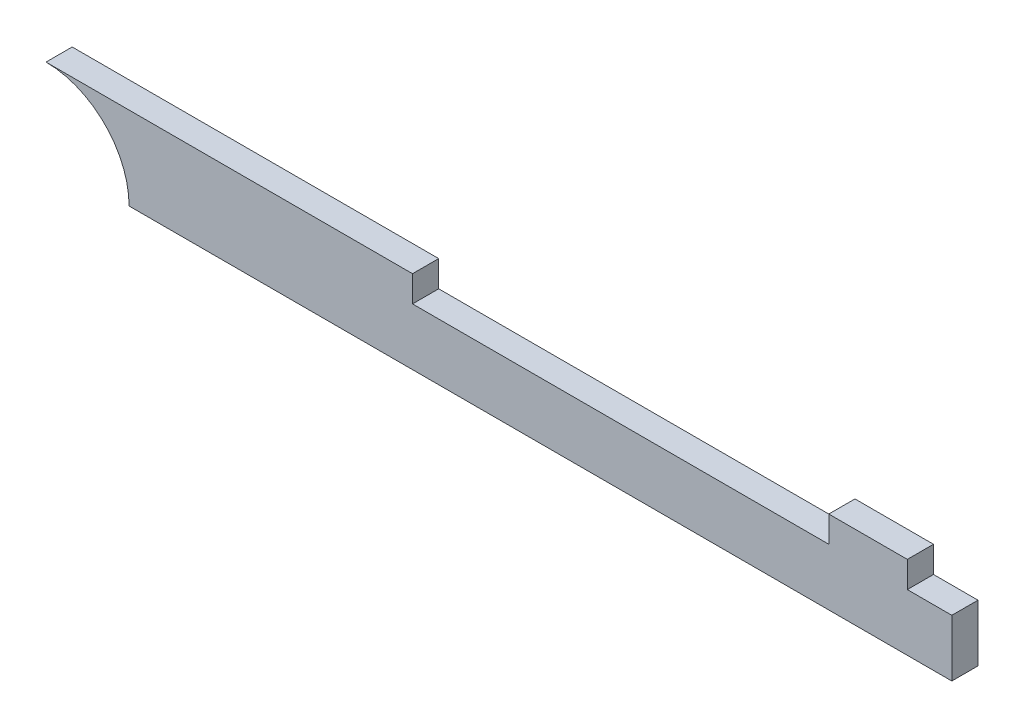
from build123d import *

# Parameters (mm, degrees)
BOSS_EXTRUDE1_DEPTH = 2.5


with BuildPart() as part:
    # Sketch1 → Boss-Extrude1 (new, symmetric)
    with BuildSketch(Plane.XY):
        with BuildLine():
            ThreePointArc((0, 15.875), (11.225320151, 11.225320151), (15.875, 0))
            Line((15.875, 0), (173, 0))
            Line((173, 0), (173, 10.875))
            Line((173, 10.875), (164.5, 10.875))
            Line((164.5, 10.875), (164.5, 15.875))
            Line((164.5, 15.875), (149.5, 15.875))
            Line((149.5, 15.875), (149.5, 10.875))
            Line((149.5, 10.875), (70, 10.875))
            Line((70, 10.875), (70, 15.875))
            Line((70, 15.875), (0, 15.875))
        make_face()
    extrude(amount=BOSS_EXTRUDE1_DEPTH, both=True)


solid = part.part
